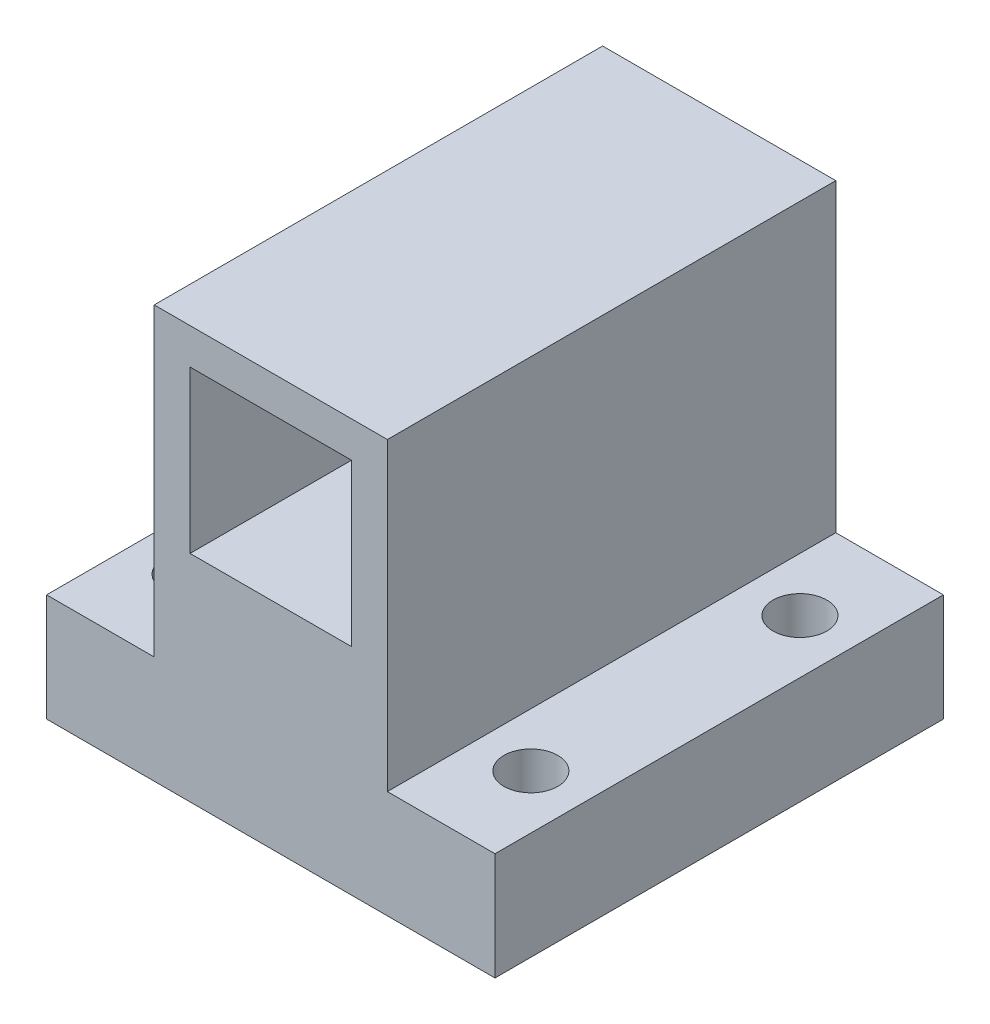
from build123d import *

# Parameters (mm, degrees)
SKETCH_1_W          = 25
SKETCH_1_H          = 25
EXTRUDE_1_DEPTH     = 23
SKETCH_2_W          = 6
SKETCH_2_H          = 25
CUT_EXTRUDE_1_DEPTH = 17
SKETCH_3_R          = 1.5
CUT_EXTRUDE_2_DEPTH = 6
SKETCH_7_W          = 9
SKETCH_7_H          = 9
CUT_EXTRUDE_3_DEPTH = 23
SKETCH_8_R          = 3.1
CUT_EXTRUDE_4_DEPTH = 23


with BuildPart() as part:
    # 草图1 → 凸台-拉伸1 (new body)
    with BuildSketch(Plane(origin=(0, 0, 0), x_dir=(1, 0, 0), z_dir=(0, 1, 0))):
        with Locations((-59.958661712, -44.921006296)):
            Rectangle(SKETCH_1_W, SKETCH_1_H)
    extrude(amount=EXTRUDE_1_DEPTH)

    # 草图2 → 切除-拉伸1 (cut)
    with BuildSketch(Plane(origin=(0, 23, 0), x_dir=(1, 0, 0), z_dir=(0, 1, 0))):
        with Locations((-69.458661712, -44.921006296)):
            Rectangle(SKETCH_2_W, SKETCH_2_H)
        with Locations((-50.458661712, -44.921006296)):
            Rectangle(SKETCH_2_W, SKETCH_2_H)
    extrude(amount=-CUT_EXTRUDE_1_DEPTH, mode=Mode.SUBTRACT)

    # 草图3 → 切除-拉伸2 (cut)
    with BuildSketch(Plane(origin=(0, 6, 0), x_dir=(1, 0, 0), z_dir=(0, 1, 0))):
        with Locations(Location((-69.458661712, -37.421006296, 0), (0, 0, 270))):
            Circle(SKETCH_3_R)
        with Locations(Location((-69.458661712, -52.421006296, 0), (0, 0, 270))):
            Circle(SKETCH_3_R)
    cut_extrude_2 = extrude(amount=-CUT_EXTRUDE_2_DEPTH, mode=Mode.SUBTRACT)

    # 镜向1: 切除-拉伸2 across plane
    add(cut_extrude_2.mirror(Plane.ZY.offset(59.958661712)), mode=Mode.SUBTRACT)

    # 草图7 → 切除-拉伸3 (cut)
    with BuildSketch(Plane.XY.offset(57.421006296)):
        with Locations((-59.958661712, 16.5)):
            Rectangle(SKETCH_7_W, SKETCH_7_H)
    extrude(amount=-CUT_EXTRUDE_3_DEPTH, mode=Mode.SUBTRACT)

    # 草图8 → 切除-拉伸4 (cut)
    with BuildSketch(Plane.XY.offset(34.421006296)):
        with Locations((-59.958661712, 16.5)):
            Circle(SKETCH_8_R)
    extrude(amount=-CUT_EXTRUDE_4_DEPTH, mode=Mode.SUBTRACT)


solid = part.part
